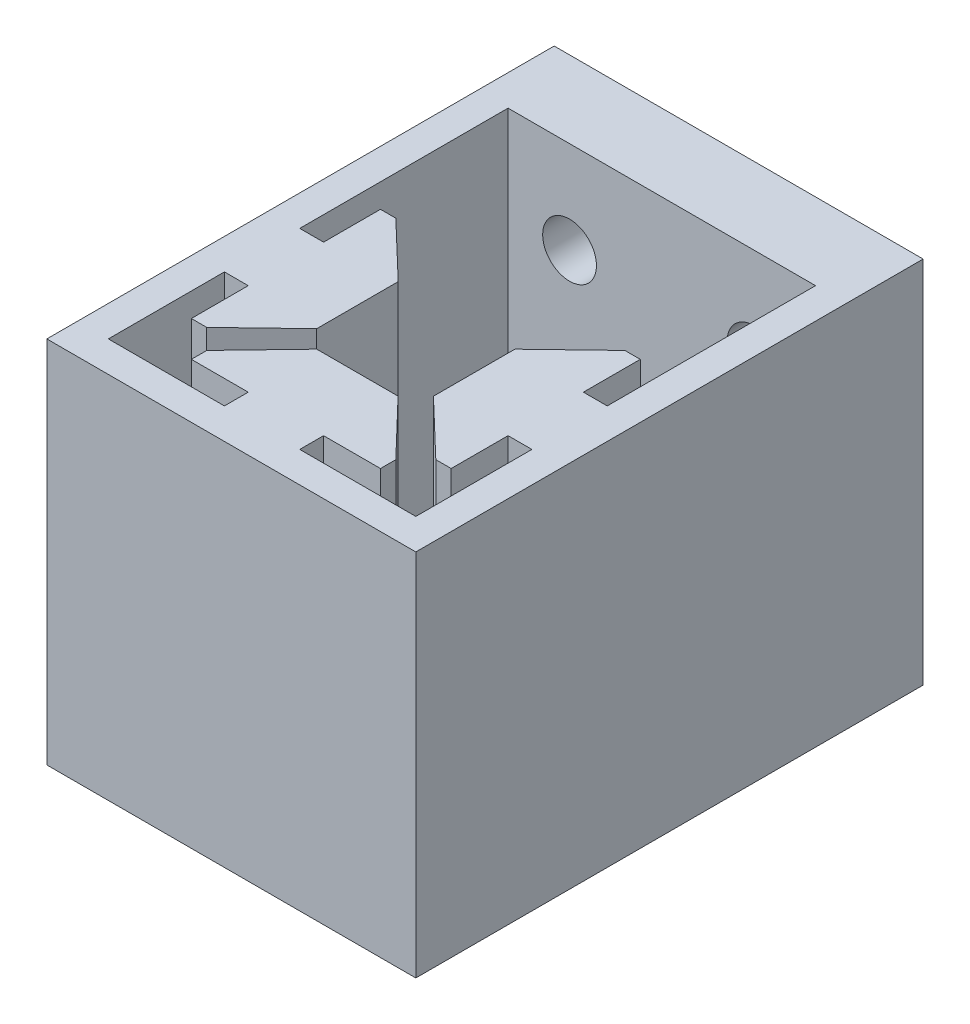
from build123d import *

# Parameters (mm, degrees)
ESQUISSE1_W             = 24
ESQUISSE1_H             = 28
BOSS_EXTRU_1_DEPTH      = 24
ENL_V_MAT_EXTRU_1_DEPTH = 24
ESQUISSE5_W             = 24
ESQUISSE5_H             = 24
BOSS_EXTRU_2_DEPTH      = 5
ENL_V_MAT_EXTRU_6_DEPTH = 24
ESQUISSE7_R             = 1.75
ENL_V_MAT_EXTRU_8_DEPTH = 5


with BuildPart() as part:
    # Esquisse1 → Boss.-Extru.1 (new body)
    with BuildSketch(Plane(origin=(0, 0, 0), x_dir=(1, 0, 0), z_dir=(0, 1, 0))):
        Rectangle(ESQUISSE1_W, ESQUISSE1_H)
    extrude(amount=BOSS_EXTRU_1_DEPTH)

    # Esquisse3 → Enlèv. mat.-Extru.1 (cut)
    with BuildSketch(Plane(origin=(0, 24, 0), x_dir=(1, 0, 0), z_dir=(0, 1, 0))):
        Polygon((-10, -12), (-2.45, -12), (-2.45, -10.45), (-6.15, -10.45), (-6.15, -9.45), (-2.645559959, -5.8), (2.645559959, -5.8), (6.15, -9.45), (6.15, -10.45), (2.45, -10.45), (2.45, -12), (10, -12), (10, -4.45), (8.45, -4.45), (8.45, -8.15), (7.45, -8.15), (3.8, -4.654440041), (3.8, 0.645559959), (7.45, 4.15), (8.45, 4.15), (8.45, 0.45), (10, 0.45), (10, 8), (2.45, 8), (2.45, 6.45), (6.15, 6.45), (6.15, 5.45), (2.645559959, 1.8), (-2.645559959, 1.8), (-6.15, 5.45), (-6.15, 6.45), (-2.45, 6.45), (-2.45, 8), (-10, 8), (-10, 0.45), (-8.45, 0.45), (-8.45, 4.15), (-7.45, 4.15), (-3.8, 0.654440041), (-3.8, -4.645559959), (-7.45, -8.15), (-8.45, -8.15), (-8.45, -4.45), (-10, -4.45), align=None)
    extrude(amount=-ENL_V_MAT_EXTRU_1_DEPTH, mode=Mode.SUBTRACT)

    # Esquisse5 → Boss.-Extru.2 (add)
    with BuildSketch(Plane(origin=(0, 0, -14), x_dir=(-1, 0, 0), z_dir=(0, 0, -1))):
        with Locations((0, 12)):
            Rectangle(ESQUISSE5_W, ESQUISSE5_H)
    extrude(amount=BOSS_EXTRU_2_DEPTH)

    # Esquisse6 → Enlèv. mat.-Extru.6 (cut)
    with BuildSketch(Plane(origin=(0, 24, 0), x_dir=(1, 0, 0), z_dir=(0, 1, 0))):
        Polygon((-10, 8), (-10, 14), (10, 14), (10, 8), (2.45, 8), (2.45, 6.45), (6.15, 6.45), (6.15, 5.45), (2.645559959, 1.8), (-2.645559959, 1.8), (-6.15, 5.45), (-6.15, 6.45), (-2.45, 6.45), (-2.45, 8), align=None)
    extrude(amount=-ENL_V_MAT_EXTRU_6_DEPTH, mode=Mode.SUBTRACT)

    # Esquisse7 → Enlèv. mat.-Extru.8 (cut)
    with BuildSketch(Plane(origin=(0, 0, -19), x_dir=(-1, 0, 0), z_dir=(0, 0, -1))):
        with Locations((-6, 18)):
            Circle(ESQUISSE7_R)
        with Locations((-6, 6)):
            Circle(ESQUISSE7_R)
        with Locations((6, 6)):
            Circle(ESQUISSE7_R)
        with Locations((6, 18)):
            Circle(ESQUISSE7_R)
    extrude(amount=-ENL_V_MAT_EXTRU_8_DEPTH, mode=Mode.SUBTRACT)


solid = part.part
